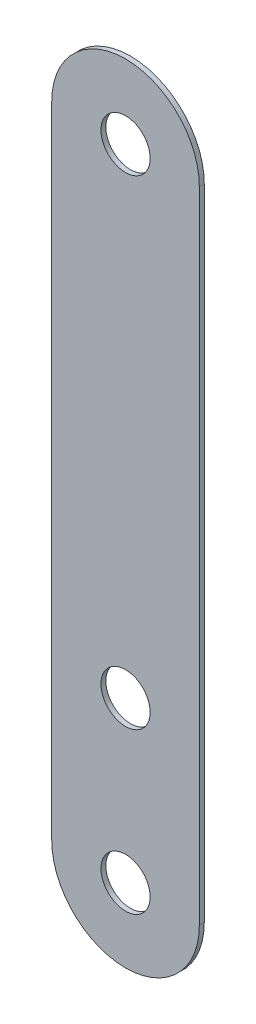
from build123d import *

# Parameters (mm, degrees)
SKETCH_1_R      = 5
EXTRUDE_1_DEPTH = 1


with BuildPart() as part:
    # Эскиз1 → Бобышка-Вытянуть1 (new body)
    with BuildSketch(Plane.XY):
        with BuildLine():
            Line((0, 0), (0, 130))
            ThreePointArc((0, 130), (15, 145), (30, 130))
            Line((30, 130), (30, 0))
            ThreePointArc((30, 0), (15, -15), (0, 0))
        make_face()
        with Locations((15, 130)):
            Circle(SKETCH_1_R, mode=Mode.SUBTRACT)
        with Locations((15, 0)):
            Circle(SKETCH_1_R, mode=Mode.SUBTRACT)
        with Locations((15, 32.5)):
            Circle(SKETCH_1_R, mode=Mode.SUBTRACT)
    extrude(amount=EXTRUDE_1_DEPTH)


solid = part.part
